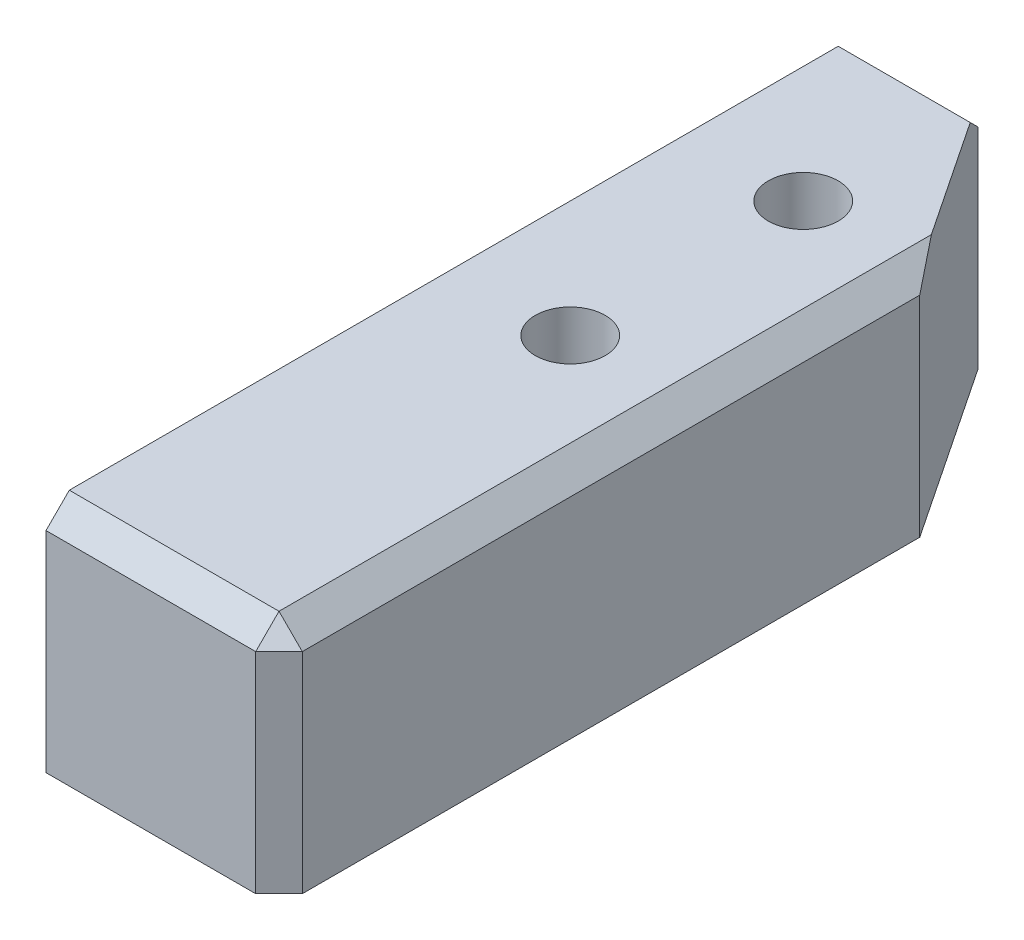
from build123d import *

# Parameters (mm, degrees)
SKETCH_1_W          = 10
SKETCH_1_H          = 35
EXTRUDE_1_DEPTH     = 10
SKETCH_2_R          = 1.5
CUT_EXTRUDE_1_DEPTH = 26.124689053
CUT_EXTRUDE_2_DEPTH = 26.124689053
CHAMFER_1_SIZE      = 1


with BuildPart() as part:
    # 草图1 → 凸台-拉伸1 (new body)
    with BuildSketch(Plane(origin=(0, 0, 0), x_dir=(1, 0, 0), z_dir=(0, 1, 0))):
        with Locations((0, -5)):
            Rectangle(SKETCH_1_W, SKETCH_1_H)
    extrude(amount=EXTRUDE_1_DEPTH)

    # 草图2 → 切除-拉伸1 (cut, through all)
    with BuildSketch(Plane(origin=(0, 10, 0), x_dir=(1, 0, 0), z_dir=(0, 1, 0))):
        with Locations(Location((0, 5, 0), (0, 0, 270))):
            Circle(SKETCH_2_R)
        with Locations(Location((0, -5, 0), (0, 0, 270))):
            Circle(SKETCH_2_R)
    extrude(amount=-CUT_EXTRUDE_1_DEPTH, mode=Mode.SUBTRACT)

    # 草图3 → 切除-拉伸2 (cut, through all)
    with BuildSketch(Plane(origin=(0, 10, 0), x_dir=(1, 0, 0), z_dir=(0, 1, 0))):
        Polygon((0, 12.5), (5, 5), (5, 12.5), align=None)
    extrude(amount=-CUT_EXTRUDE_2_DEPTH, mode=Mode.SUBTRACT)

    # 倒角1
    chamfer_1_edges = [part.edges().sort_by_distance(p)[0] for p in [
        (5, 10, 8.75),
        (-2.5, 10, -12.5),
        (0, 10, 22.5),
        (5, 5, 22.5),
    ]]
    chamfer(chamfer_1_edges, length=CHAMFER_1_SIZE)


solid = part.part
